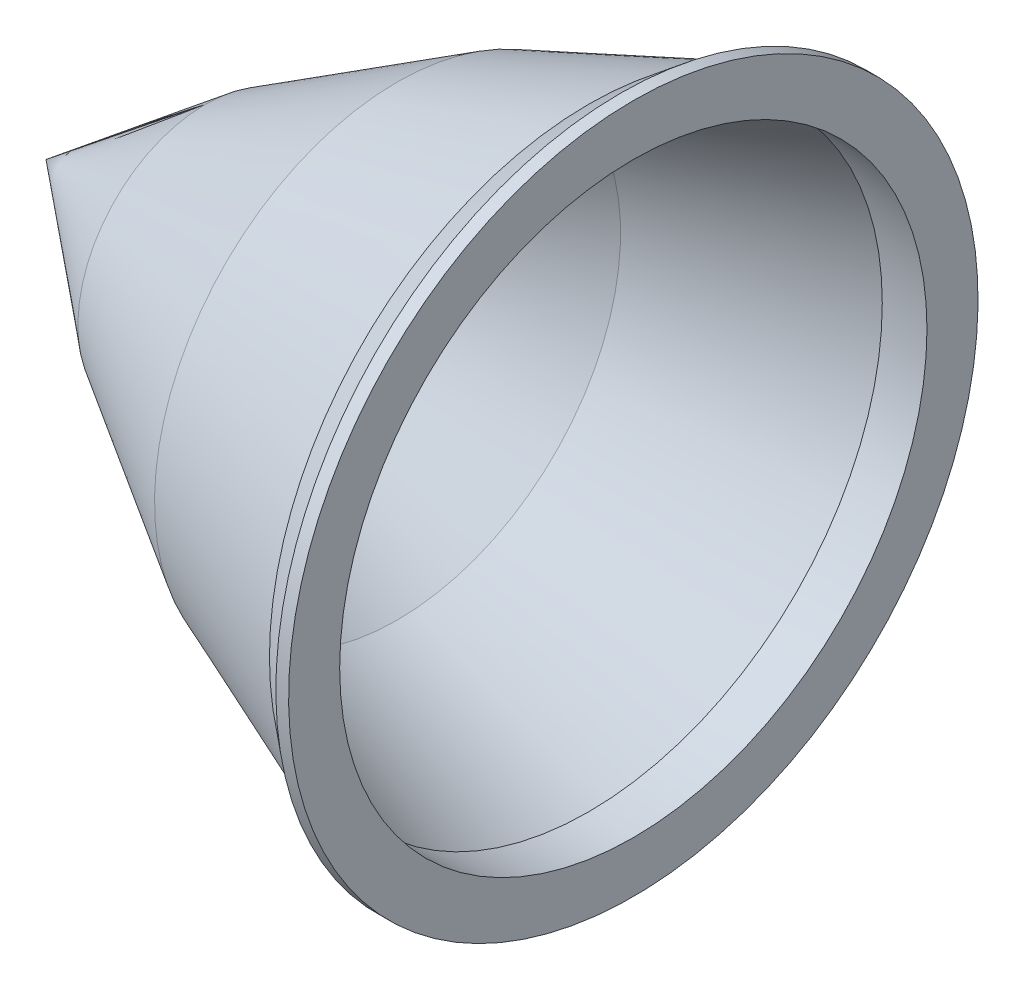
from build123d import *

# Parameters (mm, degrees)
REVOLVE1_ANGLE = 359.999999589


with BuildPart() as part:
    # Sketch1 → Revolve1 (revolve)
    with BuildSketch(Plane.XY):
        Polygon((0, 0), (250, 200), (550, 380), (850, 500), (900, 540), (920, 540), (920, 460), (850, 460), (550, 350), (250, 170), (50, 0), align=None)
    revolve(axis=Axis((0, 0, 0), (1, 0, 0)), revolution_arc=REVOLVE1_ANGLE)


solid = part.part
